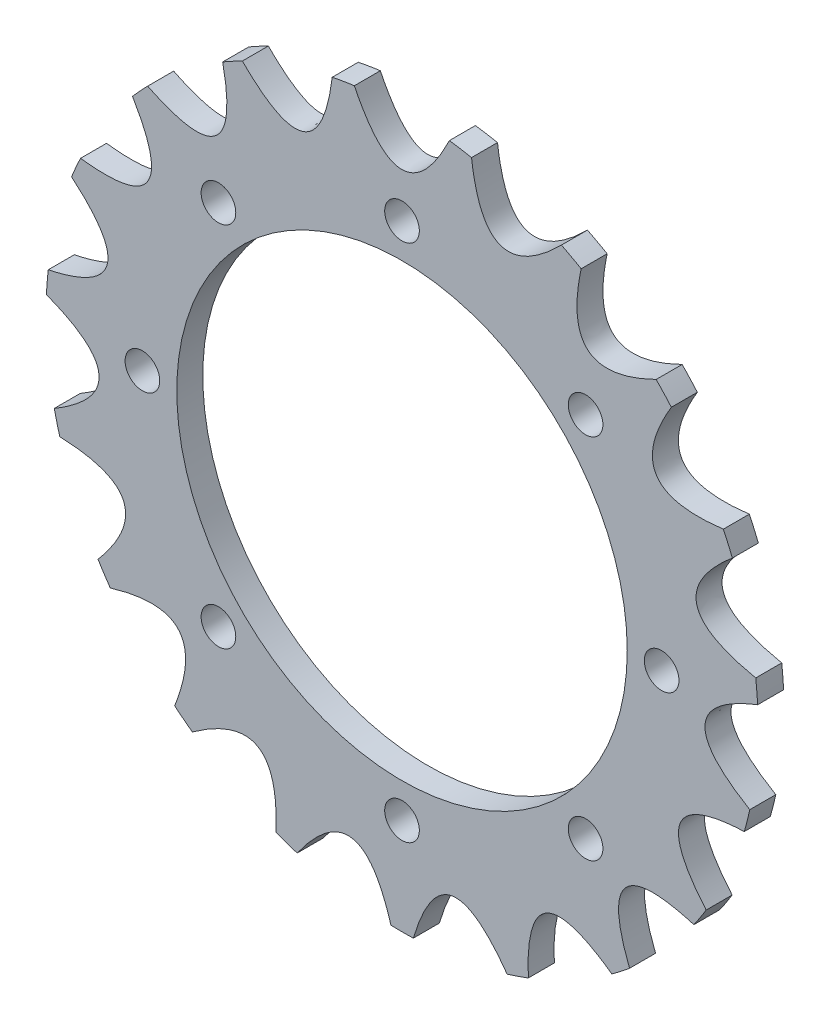
from build123d import *

# Parameters (mm, degrees)
SKETCH_1_R      = 26
SKETCH_1_R_2    = 2
EXTRUDE_1_DEPTH = 3


with BuildPart() as part:
    # Эскиз1 → Вытянуть1 (new body)
    with BuildSketch(Plane.XY):
        with BuildLine():
            ThreePointArc((-5.5, 40.730332677), (-6.779718382, 40.536963609), (-8.052713795, 40.303396886))
            add(Edge.make_bspline(
                [(-18.42711223, 36.737603826), (-9.565846889, 27.871779004), (-8.052713795, 40.303396886)],
                knots=[0, 0, 0, 1, 1, 1], degree=2))
            ThreePointArc((-18.42711223, 36.737603826), (-19.574705107, 36.139188148), (-20.702887125, 35.504935779))
            add(Edge.make_bspline(
                [(-29.357360924, 28.763785557), (-18.097494767, 23.255583732), (-20.702887125, 35.504935779)],
                knots=[0, 0, 0, 1, 1, 1], degree=2))
            ThreePointArc((-29.357360924, 28.763785557), (-30.2484688, 27.825170893), (-31.109581398, 26.858963965))
            add(Edge.make_bspline(
                [(-37.106284036, 17.672964807), (-24.667998276, 16.119285114), (-31.109581398, 26.858963965)],
                knots=[0, 0, 0, 1, 1, 1], degree=2))
            ThreePointArc((-37.106284036, 17.672964807), (-37.644341546, 16.49586462), (-38.145069811, 15.302406645))
            add(Edge.make_bspline(
                [(-40.834165508, 4.667004096), (-28.565341408, 7.236211838), (-38.145069811, 15.302406645)],
                knots=[0, 0, 0, 1, 1, 1], degree=2))
            ThreePointArc((-40.834165508, 4.667004096), (-40.960865773, 3.378975456), (-41.046948028, 2.087596124))
            add(Edge.make_bspline(
                [(-40.137031541, -8.844698925), (-29.367186562, -2.431017271), (-41.046948028, 2.087596124)],
                knots=[0, 0, 0, 1, 1, 1], degree=2))
            ThreePointArc((-40.137031541, -8.844698925), (-39.83864462, -10.104078129), (-39.500752518, -11.353437829))
            add(Edge.make_bspline(
                [(-35.090427416, -21.397941578), (-26.986641373, -11.834807939), (-39.500752518, -11.353437829)],
                knots=[0, 0, 0, 1, 1, 1], degree=2))
            ThreePointArc((-35.090427416, -21.397941578), (-34.399288162, -22.492198068), (-33.674037554, -23.564150627))
            add(Edge.make_bspline(
                [(-26.241230996, -31.632385237), (-21.68167485, -19.95611353), (-33.674037554, -23.564150627)],
                knots=[0, 0, 0, 1, 1, 1], degree=2))
            ThreePointArc((-26.241230996, -31.632385237), (-25.232235072, -32.442939344), (-24.198218116, -33.221322069))
            add(Edge.make_bspline(
                [(-14.548390024, -38.438969129), (-14.027162432, -25.91486457), (-24.198218116, -33.221322069)],
                knots=[0, 0, 0, 1, 1, 1], degree=2))
            ThreePointArc((-14.548390024, -38.438969129), (-13.330877794, -38.877984737), (-12.10014627, -39.278447783))
            add(Edge.make_bspline(
                [(-1.27900525, -41.080094274), (-4.85258931, -29.065337922), (-12.10014627, -39.278447783)],
                knots=[0, 0, 0, 1, 1, 1], degree=2))
            ThreePointArc((-1.27900525, -41.080094274), (0.015086944, -41.099997231), (1.309164177, -41.079144212))
            add(Edge.make_bspline(
                [(12.128979588, -39.269553781), (4.84783716, -29.066130916), (1.309164177, -41.079144212)],
                knots=[0, 0, 0, 1, 1, 1], degree=2))
            ThreePointArc((12.128979588, -39.269553781), (13.359416777, -38.868187292), (14.576606372, -38.428277956))
            add(Edge.make_bspline(
                [(24.222601287, -33.203547806), (14.022925251, -25.917157617), (14.576606372, -38.428277956)],
                knots=[0, 0, 0, 1, 1, 1], degree=2))
            ThreePointArc((24.222601287, -33.203547806), (25.256046509, -32.424406158), (26.264447087, -31.613111508))
            add(Edge.make_bspline(
                [(33.691328284, -23.53942222), (21.678411803, -19.959658145), (26.264447087, -31.613111508)],
                knots=[0, 0, 0, 1, 1, 1], degree=2))
            ThreePointArc((33.691328284, -23.53942222), (34.415791714, -22.466937501), (35.106127425, -21.3721739))
            add(Edge.make_bspline(
                [(39.509077087, -11.324434984), (26.984706061, -11.839220006), (35.106127425, -21.3721739)],
                knots=[0, 0, 0, 1, 1, 1], degree=2))
            ThreePointArc((39.509077087, -11.324434984), (39.846051872, -10.074827555), (40.143514129, -8.815229627))
            add(Edge.make_bspline(
                [(41.045404341, 2.117730498), (29.366788706, -2.435818675), (40.143514129, -8.815229627)],
                knots=[0, 0, 0, 1, 1, 1], degree=2))
            ThreePointArc((41.045404341, 2.117730498), (40.958374033, 3.409046284), (40.830728186, 4.696981559))
            add(Edge.make_bspline(
                [(38.13382515, 15.330407021), (28.566524123, 7.231541404), (40.830728186, 4.696981559)],
                knots=[0, 0, 0, 1, 1, 1], degree=2))
            ThreePointArc((38.13382515, 15.330407021), (37.632220833, 16.523497062), (37.093299291, 17.700201912))
            add(Edge.make_bspline(
                [(31.089854296, 26.881796068), (24.670633395, 16.115251764), (37.093299291, 17.700201912)],
                knots=[0, 0, 0, 1, 1, 1], degree=2))
            ThreePointArc((31.089854296, 26.881796068), (30.228032583, 27.847370544), (29.336235855, 28.785330741))
            add(Edge.make_bspline(
                [(20.676815321, 35.520125397), (18.101296735, 23.252624541), (29.336235855, 28.785330741)],
                knots=[0, 0, 0, 1, 1, 1], degree=2))
            ThreePointArc((20.676815321, 35.520125397), (19.548167965, 36.153549331), (18.400136066, 36.751122333))
            add(Edge.make_bspline(
                [(8.023122571, 40.309297987), (9.570403703, 27.870214648), (18.400136066, 36.751122333)],
                knots=[0, 0, 0, 1, 1, 1], degree=2))
            ThreePointArc((8.023122571, 40.309297987), (6.749956027, 40.541930068), (5.470096027, 40.734359569))
            add(Edge.make_bspline(
                [(-5.5, 40.730332677), (0.00240893, 29.467634546), (5.470096027, 40.734359569)],
                knots=[0, 0, 0, 1, 1, 1], degree=2))
        make_face()
        Circle(SKETCH_1_R, mode=Mode.SUBTRACT)
        with Locations((0, 29.966593386)):
            Circle(SKETCH_1_R_2, mode=Mode.SUBTRACT)
        with Locations((21.189581392, 21.189581392)):
            Circle(SKETCH_1_R_2, mode=Mode.SUBTRACT)
        with Locations((29.966593386, 0)):
            Circle(SKETCH_1_R_2, mode=Mode.SUBTRACT)
        with Locations((21.189581392, -21.189581392)):
            Circle(SKETCH_1_R_2, mode=Mode.SUBTRACT)
        with Locations((0, -29.966593386)):
            Circle(SKETCH_1_R_2, mode=Mode.SUBTRACT)
        with Locations((-21.189581392, -21.189581392)):
            Circle(SKETCH_1_R_2, mode=Mode.SUBTRACT)
        with Locations((-29.966593386, 0)):
            Circle(SKETCH_1_R_2, mode=Mode.SUBTRACT)
        with Locations((-21.189581392, 21.189581392)):
            Circle(SKETCH_1_R_2, mode=Mode.SUBTRACT)
    extrude(amount=EXTRUDE_1_DEPTH)


solid = part.part
